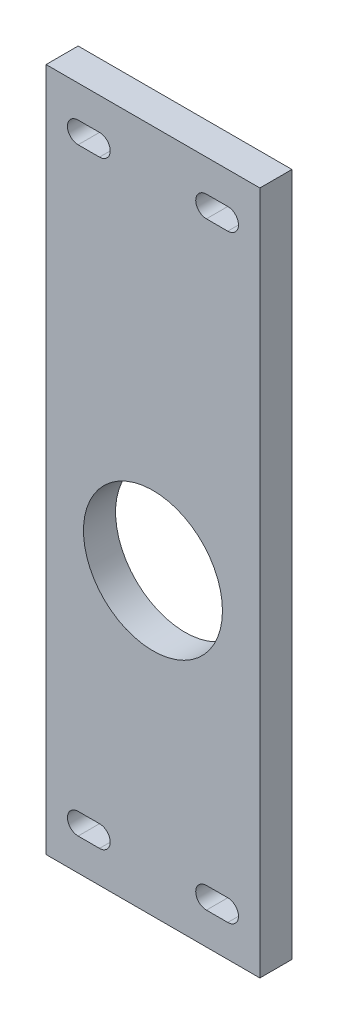
from build123d import *

# Parameters (mm, degrees)
SKETCH1_W            = 63.5
SKETCH1_H            = 203.2
BOSS_EXTRUDE1_DEPTH  = 9.525
CUT_EXTRUDE1_DEPTH   = 107.870707516
LPATTERN1_COUNT      = 2
LPATTERN1_PITCH      = 38.1
LPATTERN1_COUNT_DIR2 = 2
LPATTERN1_PITCH_DIR2 = 177.8
SKETCH3_R            = 20.6375
CUT_EXTRUDE2_DEPTH   = 107.870707516


with BuildPart() as part:
    # Sketch1 → Boss-Extrude1 (new body)
    with BuildSketch(Plane.XY):
        Rectangle(SKETCH1_W, SKETCH1_H)
    extrude(amount=BOSS_EXTRUDE1_DEPTH)

    # Sketch2 → Cut-Extrude1 (cut, through all)
    with BuildSketch(Plane.XY.offset(9.525)):
        with BuildLine():
            Line((-22.225, 92.075), (-15.875, 92.075))
            ThreePointArc((-15.875, 92.075), (-12.7, 88.9), (-15.875, 85.725))
            Line((-15.875, 85.725), (-22.225, 85.725))
            ThreePointArc((-22.225, 85.725), (-25.4, 88.9), (-22.225, 92.075))
        make_face()
    cut_extrude1 = extrude(amount=-CUT_EXTRUDE1_DEPTH, mode=Mode.SUBTRACT)

    # LPattern1: Cut-Extrude1 2 × 2
    with Locations(*[(i * LPATTERN1_PITCH, -j * LPATTERN1_PITCH_DIR2, 0) for i in range(LPATTERN1_COUNT) for j in range(LPATTERN1_COUNT_DIR2) if (i, j) != (0, 0)]):
        add(cut_extrude1, mode=Mode.SUBTRACT)

    # Sketch3 → Cut-Extrude2 (cut, through all)
    with BuildSketch(Plane.XY.offset(9.525)):
        with Locations((0, -12.7)):
            Circle(SKETCH3_R)
    extrude(amount=-CUT_EXTRUDE2_DEPTH, mode=Mode.SUBTRACT)


solid = part.part
